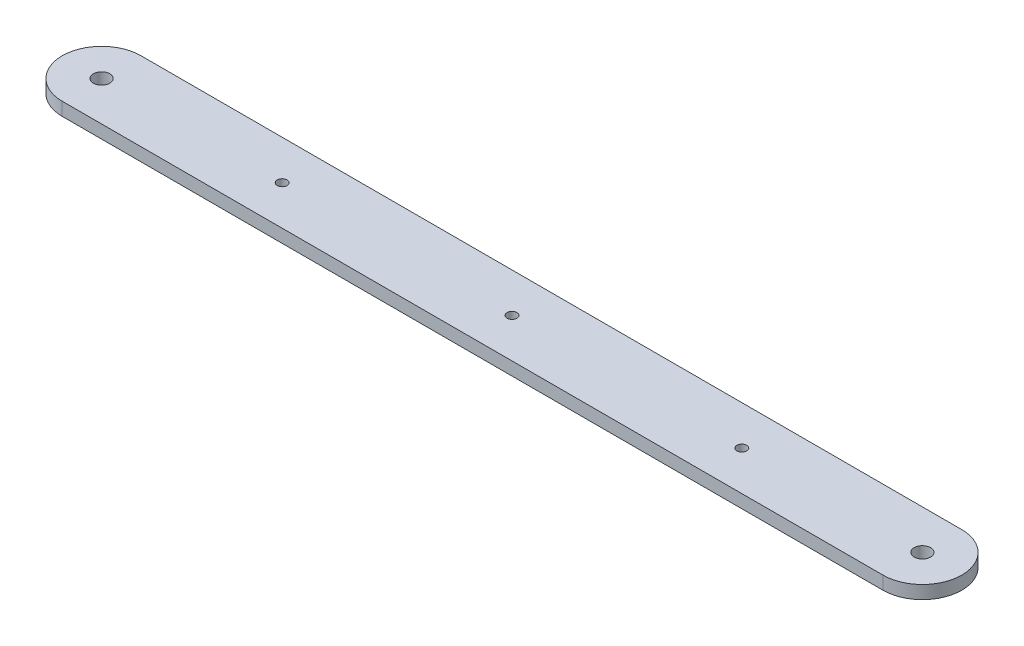
from build123d import *

# Parameters (mm, degrees)
SKETCH_1_R          = 2.5
EXTRUDE_1_DEPTH     = 4
SKETCH_2_R          = 1.5
CUT_EXTRUDE_1_DEPTH = 4


with BuildPart() as part:
    # 草图1 → 凸台-拉伸1 (new body)
    with BuildSketch(Plane(origin=(0, 0, 0), x_dir=(1, 0, 0), z_dir=(0, 1, 0))):
        with BuildLine():
            Line((-125, 12), (125, 12))
            ThreePointArc((125, 12), (137, 0), (125, -12))
            Line((125, -12), (-125, -12))
            ThreePointArc((-125, -12), (-137, 0), (-125, 12))
        make_face()
        with Locations(Location((125, 0, 0), (0, 0, 270))):
            Circle(SKETCH_1_R, mode=Mode.SUBTRACT)
        with Locations(Location((-125, 0, 0), (0, 0, 270))):
            Circle(SKETCH_1_R, mode=Mode.SUBTRACT)
    extrude(amount=EXTRUDE_1_DEPTH)

    # 草图2 → 切除-拉伸1 (cut)
    with BuildSketch(Plane.XZ):
        with Locations(Location((-70, 0, 0), (0, 0, 270))):
            Circle(SKETCH_2_R)
        with Locations(Location((0, 0, 0), (0, 0, 270))):
            Circle(SKETCH_2_R)
        with Locations(Location((70, 0, 0), (0, 0, 270))):
            Circle(SKETCH_2_R)
    extrude(amount=-CUT_EXTRUDE_1_DEPTH, mode=Mode.SUBTRACT)


solid = part.part
